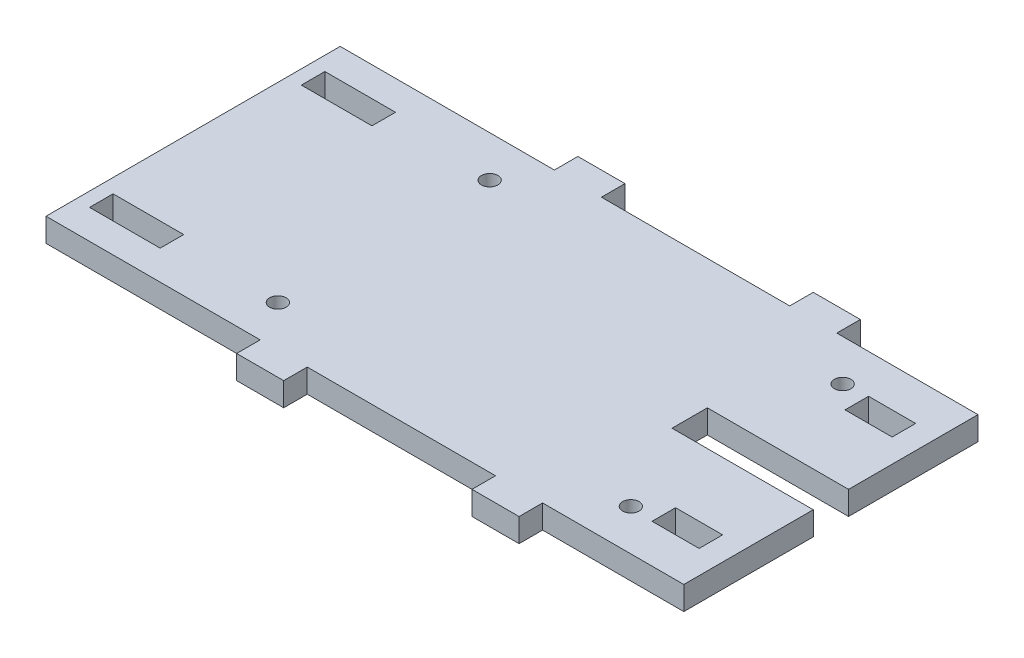
from build123d import *

# Parameters (mm, degrees)
SKETCH1_R           = 1.75
SKETCH1_W           = 10
SKETCH1_H           = 5
SKETCH1_W_2         = 15
BOSS_EXTRUDE1_DEPTH = 5
SKETCH3_R           = 3.175
CUT_EXTRUDE1_DEPTH  = 2


with BuildPart() as part:
    # Sketch1 → Boss-Extrude1 (new body)
    with BuildSketch(Plane(origin=(0, 0, 0), x_dir=(1, 0, 0), z_dir=(0, 1, 0))):
        Polygon((3.647196653, 31.359118607), (3.647196653, 36.359118607), (13.647196653, 36.359118607), (13.647196653, 31.359118607), (53.647196653, 31.359118607), (53.647196653, 36.359118607), (63.647196653, 36.359118607), (63.647196653, 31.359118607), (93.647196653, 31.359118607), (93.647196653, 3.859118607), (63.647196653, 3.859118607), (63.647196653, -3.640881393), (93.647196653, -3.640881393), (93.647196653, -31.140881393), (63.647196653, -31.140881393), (63.647196653, -36.140881393), (53.647196653, -36.140881393), (53.647196653, -31.140881393), (13.647196653, -31.140881393), (13.647196653, -36.140881393), (3.647196653, -36.140881393), (3.647196653, -31.140881393), (-41.852803347, -31.140881393), (-41.852803347, 31.359118607), align=None)
        with Locations(Location((73.647196653, 22.609118607, 0), (0, 0, 270))):
            Circle(SKETCH1_R, mode=Mode.SUBTRACT)
        with Locations(Location((-1.352803347, 22.609118607, 0), (0, 0, 270))):
            Circle(SKETCH1_R, mode=Mode.SUBTRACT)
        with Locations(Location((73.647196653, -22.390881393, 0), (0, 0, 270))):
            Circle(SKETCH1_R, mode=Mode.SUBTRACT)
        with Locations(Location((-1.352803347, -22.390881393, 0), (0, 0, 270))):
            Circle(SKETCH1_R, mode=Mode.SUBTRACT)
        with Locations((83.647196653, -20.390881393)):
            Rectangle(SKETCH1_W, SKETCH1_H, mode=Mode.SUBTRACT)
        with Locations((-31.352803347, -22.390881393)):
            Rectangle(SKETCH1_W_2, SKETCH1_H, mode=Mode.SUBTRACT)
        with Locations((-31.352803347, 22.609118607)):
            Rectangle(SKETCH1_W_2, SKETCH1_H, mode=Mode.SUBTRACT)
        with Locations((83.647196653, 20.609118607)):
            Rectangle(SKETCH1_W, SKETCH1_H, mode=Mode.SUBTRACT)
    extrude(amount=BOSS_EXTRUDE1_DEPTH)

    # Sketch3 → Cut-Extrude1 (cut)
    with BuildSketch(Plane.XZ):
        with Locations(Location((-1.352803347, 22.390881393, 0), (0, 0, 270))):
            Circle(SKETCH3_R)
        with Locations(Location((73.647196653, 22.390881393, 0), (0, 0, 270))):
            Circle(SKETCH3_R)
        with Locations(Location((-1.352803347, -22.609118607, 0), (0, 0, 270))):
            Circle(SKETCH3_R)
        with Locations(Location((73.647196653, -22.609118607, 0), (0, 0, 270))):
            Circle(SKETCH3_R)
    extrude(amount=-CUT_EXTRUDE1_DEPTH, mode=Mode.SUBTRACT)


solid = part.part
